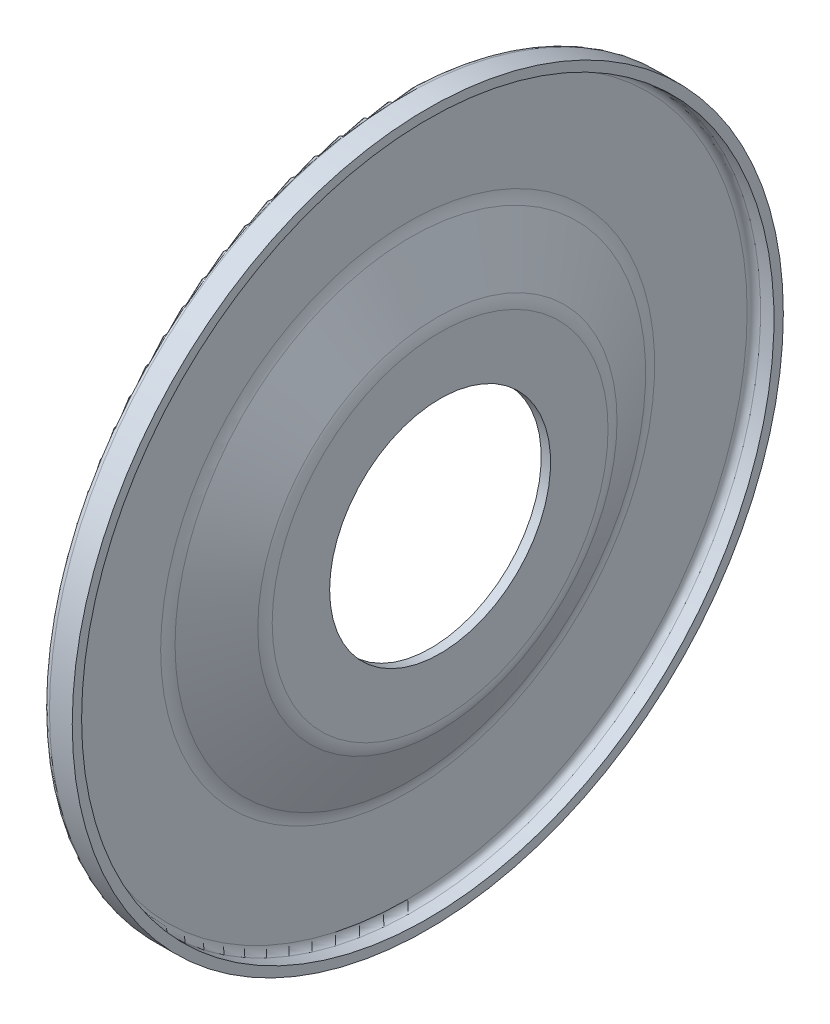
from build123d import *


with BuildPart() as part:
    # Croquis1 → Revolución1 (revolve)
    with BuildSketch(Plane.XY, mode=Mode.PRIVATE) as revoluci_n1_sk:
        with BuildLine():
            Line((22.04302495, 8.25), (22.04302495, 12.539688269))
            ThreePointArc((22.04302495, 12.539688269), (21.992068941, 12.988272176), (21.841797428, 13.413998037))
            Line((21.841797428, 13.413998037), (19.821148762, 17.571205632))
            ThreePointArc((19.821148762, 17.571205632), (19.670877249, 17.996931493), (19.61992124, 18.4455154))
            Line((19.61992124, 18.4455154), (19.61992124, 25.35108569))
            ThreePointArc((19.61992124, 25.35108569), (19.76636785, 25.704639081), (20.11992124, 25.85108569))
            Line((20.11992124, 25.85108569), (21.12262967, 25.85108569))
            Line((21.12262967, 25.85108569), (21.12262967, 26.55108569))
            Line((21.12262967, 26.55108569), (19.41992124, 26.55108569))
            ThreePointArc((19.41992124, 26.55108569), (19.06636785, 26.404639081), (18.91992124, 26.05108569))
            Line((18.91992124, 26.05108569), (18.91992124, 18.284406294))
            ThreePointArc((18.91992124, 18.284406294), (18.970877249, 17.835822387), (19.121148762, 17.410096526))
            Line((19.121148762, 17.410096526), (21.141797428, 13.252888931))
            ThreePointArc((21.141797428, 13.252888931), (21.292068941, 12.82716307), (21.34302495, 12.378579163))
            Line((21.34302495, 12.378579163), (21.34302495, 8.25))
            Line((21.34302495, 8.25), (22.04302495, 8.25))
        make_face()
    revolve(revoluci_n1_sk.sketch.rotate(Axis((0, 0, 0), (1, 0, 0)), 90), axis=Axis((0, 0, 0), (1, 0, 0)))


solid = part.part
